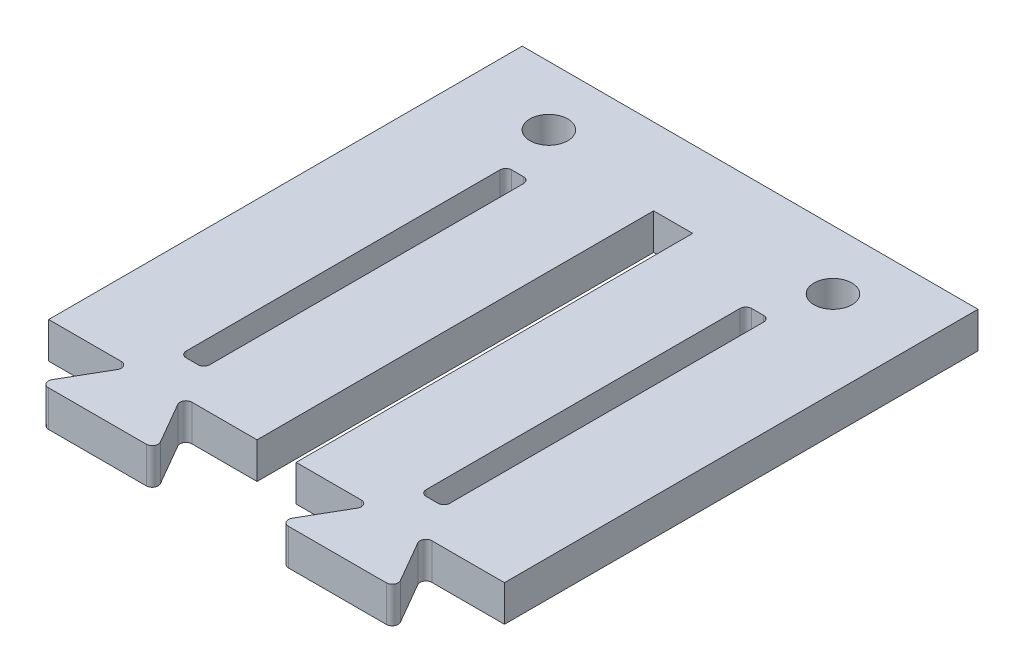
from build123d import *

# Parameters (mm, degrees)
BOSS_EXTRUDE1_DEPTH         = 3.05
FILLET1_R                   = 0.5
SKETCH3_W                   = 3.3
SKETCH3_H                   = 61.8
SKETCH3_H_2                 = 1
CUT_EXTRUDE2_DEPTH          = 45.495673947
SKETCH8_W                   = 2
SKETCH8_H                   = 27.5
CUT_EXTRUDE3_DEPTH          = 45.495673947
FILLET2_R                   = 0.5
M3_CLEARANCE_DAMPER_HOLES_D = 3.2


with BuildPart() as part:
    # Sketch1 → Boss-Extrude1 (new body)
    with BuildSketch(Plane(origin=(0, 0, 0), x_dir=(1, 0, 0), z_dir=(0, 1, 0))):
        Polygon((-19.25, 0), (-19.25, 40), (19.25, 40), (19.25, 0), (12.25, 0), (15.136751346, -5), (5.136751346, -5), (8.023502692, 0), (-8.023502692, 0), (-5.136751346, -5), (-15.136751346, -5), (-12.25, 0), align=None)
    extrude(amount=BOSS_EXTRUDE1_DEPTH)

    # Fillet1
    fillet1_edges = [part.edges().sort_by_distance(p)[0] for p in [
        (12.25, 1.525, 0),
        (15.136751346, 1.525, 5),
        (5.136751346, 1.525, 5),
        (8.023502692, 1.525, 0),
        (-8.023502692, 1.525, 0),
        (-5.136751346, 1.525, 5),
        (-15.136751346, 1.525, 5),
        (-12.25, 1.525, 0),
    ]]
    fillet(fillet1_edges, radius=FILLET1_R)

    # Sketch3 → Cut-Extrude2 (cut, through all)
    with BuildSketch(Plane(origin=(0, 3.05, 0), x_dir=(1, 0, 0), z_dir=(0, 1, 0))):
        with Locations((0, 2.6)):
            Rectangle(SKETCH3_W, SKETCH3_H)
        with Locations((0, -30)):
            Rectangle(SKETCH3_W, SKETCH3_H_2)
    extrude(amount=-CUT_EXTRUDE2_DEPTH, mode=Mode.SUBTRACT)

    # Sketch8 → Cut-Extrude3 (cut, through all)
    with BuildSketch(Plane(origin=(0, 3.05, 0), x_dir=(1, 0, 0), z_dir=(0, 1, 0))):
        with Locations((-10.136751346, 16.75)):
            Rectangle(SKETCH8_W, SKETCH8_H)
        with Locations((10.136751346, 16.75)):
            Rectangle(SKETCH8_W, SKETCH8_H)
    extrude(amount=-CUT_EXTRUDE3_DEPTH, mode=Mode.SUBTRACT)

    # Fillet2
    fillet2_edges = [part.edges().sort_by_distance(p)[0] for p in [
        (-11.136751346, 1.525, -3),
        (-11.136751346, 1.525, -30.5),
        (-9.136751346, 1.525, -30.5),
        (-9.136751346, 1.525, -3),
        (11.136751346, 1.525, -30.5),
        (11.136751346, 1.525, -3),
        (9.136751346, 1.525, -3),
        (9.136751346, 1.525, -30.5),
    ]]
    fillet(fillet2_edges, radius=FILLET2_R)

    # M3 Clearance Damper Holes (through all)
    with Locations(Plane(origin=(0, 3.05, 0), x_dir=(1, 0, 0), z_dir=(0, 1, 0))):
        with Locations((-12, 35), (12, 35)):
            Hole(M3_CLEARANCE_DAMPER_HOLES_D / 2)


solid = part.part
